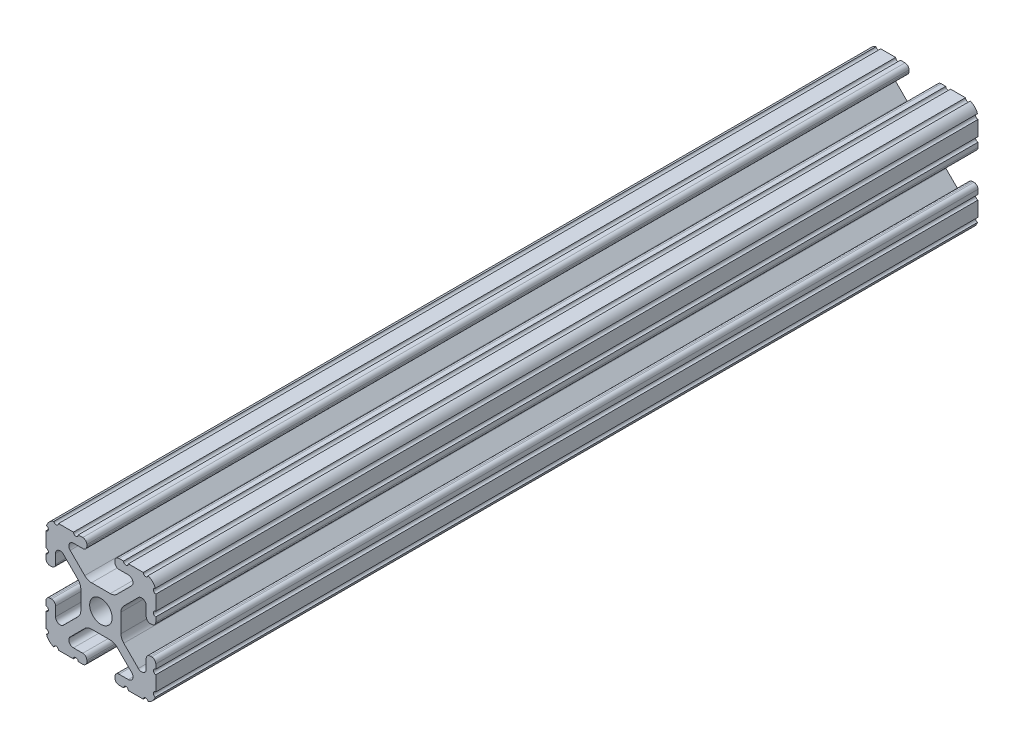
from build123d import *

# Parameters (mm, degrees)
BOSS_EXTRUDE1_START     = -95.123
BOSS_EXTRUDE1_DEPTH     = 190.246
CUT_EXTRUDE1_DEPTH      = 97.803745429
CUT_EXTRUDE1_DEPTH_BACK = 97.803745429
SKETCH5_R               = 0.55245


with BuildPart() as part:
    # Sketch4 → Boss-Extrude1 (new body)
    with BuildSketch(Plane.XY.offset(BOSS_EXTRUDE1_START)):
        with BuildLine():
            Line((4.190365, -12.7), (10.11729625, -12.7))
            ThreePointArc((10.11729625, -12.7), (11.943543585, -11.943543585), (12.7, -10.11729625))
            Line((12.7, -10.11729625), (12.7, -4.190365))
            ThreePointArc((12.7, -4.190365), (12.42492494, -3.52627506), (11.760835, -3.2512))
            Line((11.760835, -3.2512), (11.429365, -3.2512))
            ThreePointArc((11.429365, -3.2512), (10.76527506, -3.52627506), (10.4902, -4.190365))
            Line((10.4902, -4.190365), (10.4902, -6.348478019))
            ThreePointArc((10.4902, -6.348478019), (9.830707141, -7.335478831), (8.666460301, -7.103895736))
            Line((8.666460301, -7.103895736), (5.299899128, -3.737334563))
            ThreePointArc((5.299899128, -3.737334563), (4.817571085, -3.015479634), (4.6482, -2.16399369))
            Line((4.6482, -2.16399369), (4.6482, 0))
            Line((4.6482, 0), (2.6035, 0))
            ThreePointArc((2.6035, 0), (1.840952505, -1.840952505), (0, -2.6035))
            Line((0, -2.6035), (0, -4.6482))
            Line((0, -4.6482), (2.16399369, -4.6482))
            ThreePointArc((2.16399369, -4.6482), (3.015479634, -4.817571085), (3.737334563, -5.299899128))
            Line((3.737334563, -5.299899128), (7.103895736, -8.666460301))
            ThreePointArc((7.103895736, -8.666460301), (7.335478831, -9.830707141), (6.348478019, -10.4902))
            Line((6.348478019, -10.4902), (4.190365, -10.4902))
            ThreePointArc((4.190365, -10.4902), (3.52627506, -10.76527506), (3.2512, -11.429365))
            Line((3.2512, -11.429365), (3.2512, -11.760835))
            ThreePointArc((3.2512, -11.760835), (3.52627506, -12.42492494), (4.190365, -12.7))
        make_face()
    extrude(amount=BOSS_EXTRUDE1_DEPTH)

    # Sketch5 → Cut-Extrude1 (cut, two sides: drawn at the far end of the back side and taken through both)
    with BuildSketch(Plane.XY.offset(-CUT_EXTRUDE1_DEPTH_BACK)):
        with Locations((10.356153152, -12.7)):
            Circle(SKETCH5_R)
        with Locations((5.796028019, -12.7)):
            Circle(SKETCH5_R)
        with Locations((12.7, -10.356153152)):
            Circle(SKETCH5_R)
        with Locations((12.7, -5.796028019)):
            Circle(SKETCH5_R)
    extrude(amount=CUT_EXTRUDE1_DEPTH + CUT_EXTRUDE1_DEPTH_BACK, mode=Mode.SUBTRACT)

    # Mirror1: part across plane


with BuildPart() as part_1:
    add(part.part)
    add(part.part.mirror(Plane(origin=(0, 0, 0), x_dir=(0, 0, 1), z_dir=(1, 0, 0))))

    # Mirror2: part across plane


with BuildPart() as part_2:
    add(part_1.part)
    add(part_1.part.mirror(Plane.ZX))


solid = part_2.part
